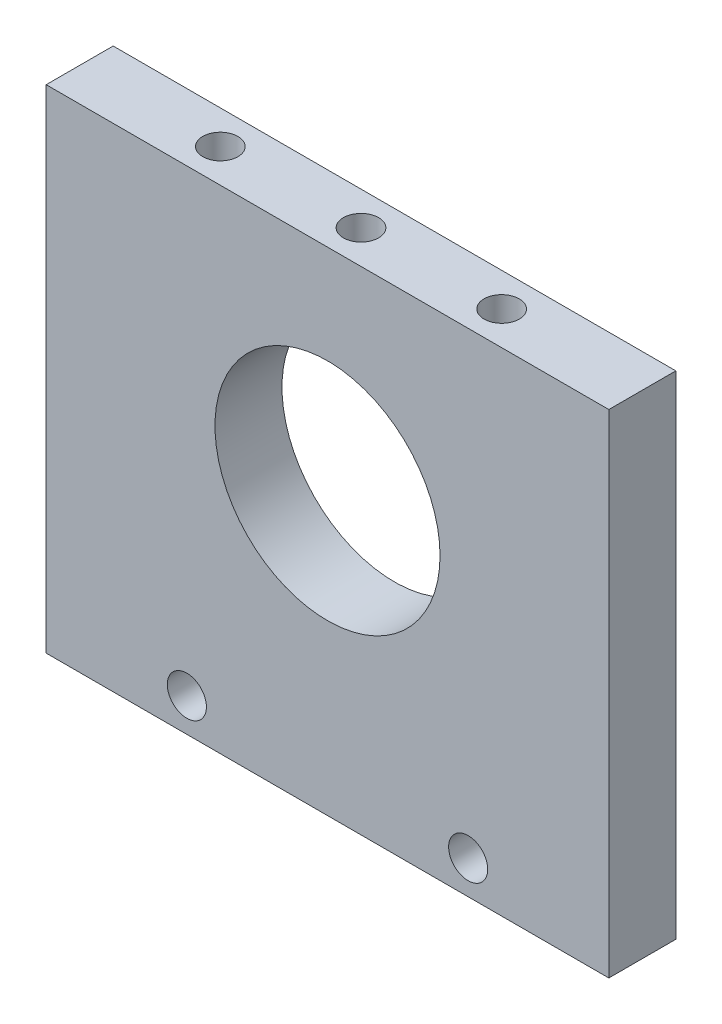
from build123d import *

# Parameters (mm, degrees)
ESBO_O1_W                = 80
ESBO_O1_H                = 70
RESSALTO_EXTRUS_O1_DEPTH = 9.525
ESBO_O2_R                = 16
CORTE_EXTRUS_O1_DEPTH    = 10
ESBO_O4_R                = 2.5
CORTE_EXTRUS_O3_DEPTH    = 23
ESBO_O5_R                = 2.78
CORTE_EXTRUS_O4_DEPTH    = 9.525


with BuildPart() as part:
    # Esboço1 → Ressalto-extrusão1 (new body)
    with BuildSketch(Plane.XY):
        Rectangle(ESBO_O1_W, ESBO_O1_H)
    extrude(amount=RESSALTO_EXTRUS_O1_DEPTH)

    # Esboço2 → Corte-extrusão1 (cut)
    with BuildSketch(Plane.XY.offset(9.525)):
        with Locations((0, 5)):
            Circle(ESBO_O2_R)
    extrude(amount=-CORTE_EXTRUS_O1_DEPTH, mode=Mode.SUBTRACT)

    # Esboço4 → Corte-extrusão3 (cut)
    with BuildSketch(Plane(origin=(0, 35, 0), x_dir=(1, 0, 0), z_dir=(0, 1, 0))):
        with Locations(Location((20, -4.7625, 0), (0, 0, 180))):
            Circle(ESBO_O4_R)
        with Locations(Location((0, -4.7625, 0), (0, 0, 180))):
            Circle(ESBO_O4_R)
        with Locations(Location((-20, -4.7625, 0), (0, 0, 180))):
            Circle(ESBO_O4_R)
    extrude(amount=-CORTE_EXTRUS_O3_DEPTH, mode=Mode.SUBTRACT)

    # Esboço5 → Corte-extrusão4 (cut)
    with BuildSketch(Plane.XY.offset(9.525)):
        with Locations((-20, -30.24)):
            Circle(ESBO_O5_R)
        with Locations((20, -30.24)):
            Circle(ESBO_O5_R)
    extrude(amount=-CORTE_EXTRUS_O4_DEPTH, mode=Mode.SUBTRACT)


solid = part.part
